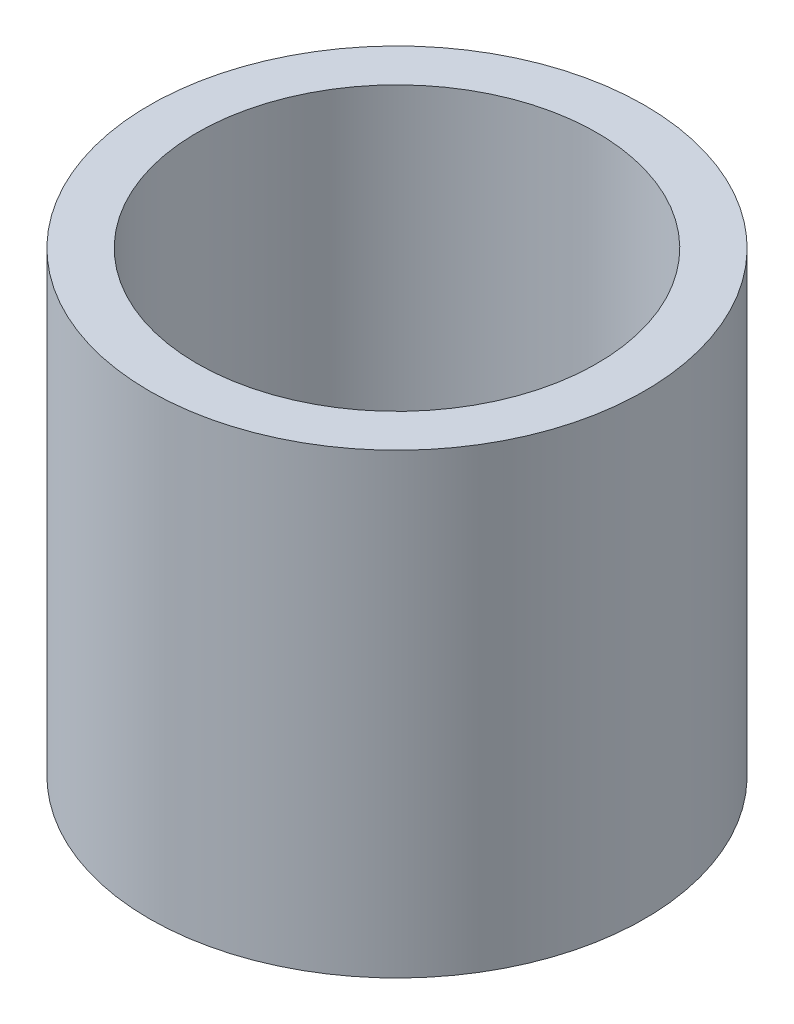
from build123d import *

# Parameters (mm, degrees)
SKETCH1_R               = 130
BOSS_EXTRUDE1_DEPTH     = 240
SKETCH2_R               = 105
CUT_EXTRUDE1_DEPTH      = 170
CUT_EXTRUDE2_DEPTH      = 303.324329157
CUT_EXTRUDE2_DEPTH_BACK = 303.324329157
SKETCH3_R               = 12.5
SKETCH3_R_2             = 32.5


with BuildPart() as part:
    # Sketch1 → Boss-Extrude1 (new body)
    with BuildSketch(Plane(origin=(0, 0, 0), x_dir=(1, 0, 0), z_dir=(0, 1, 0))):
        with Locations(Location((0, 0, 0), (0, 0, 270))):
            Circle(SKETCH1_R)
    extrude(amount=BOSS_EXTRUDE1_DEPTH)

    # Sketch2 → Cut-Extrude1 (cut)
    with BuildSketch(Plane(origin=(0, 240, 0), x_dir=(1, 0, 0), z_dir=(0, 1, 0))):
        with Locations(Location((0, 0, 0), (0, 0, 270))):
            Circle(SKETCH2_R)
    extrude(amount=-CUT_EXTRUDE1_DEPTH, mode=Mode.SUBTRACT)

    # Sketch3 → Cut-Extrude2 (cut, two sides: drawn at the far end of the back side and taken through both)
    with BuildSketch(Plane.XZ.offset(-CUT_EXTRUDE2_DEPTH_BACK)):
        with Locations(Location((-90, 0, 0), (0, 0, 90))):
            Circle(SKETCH3_R)
        with Locations(Location((90, 0, 0), (0, 0, 90))):
            Circle(SKETCH3_R)
        with Locations(Location((0, 0, 0), (0, 0, 90))):
            Circle(SKETCH3_R_2)
    extrude(amount=CUT_EXTRUDE2_DEPTH + CUT_EXTRUDE2_DEPTH_BACK, mode=Mode.SUBTRACT)


solid = part.part
